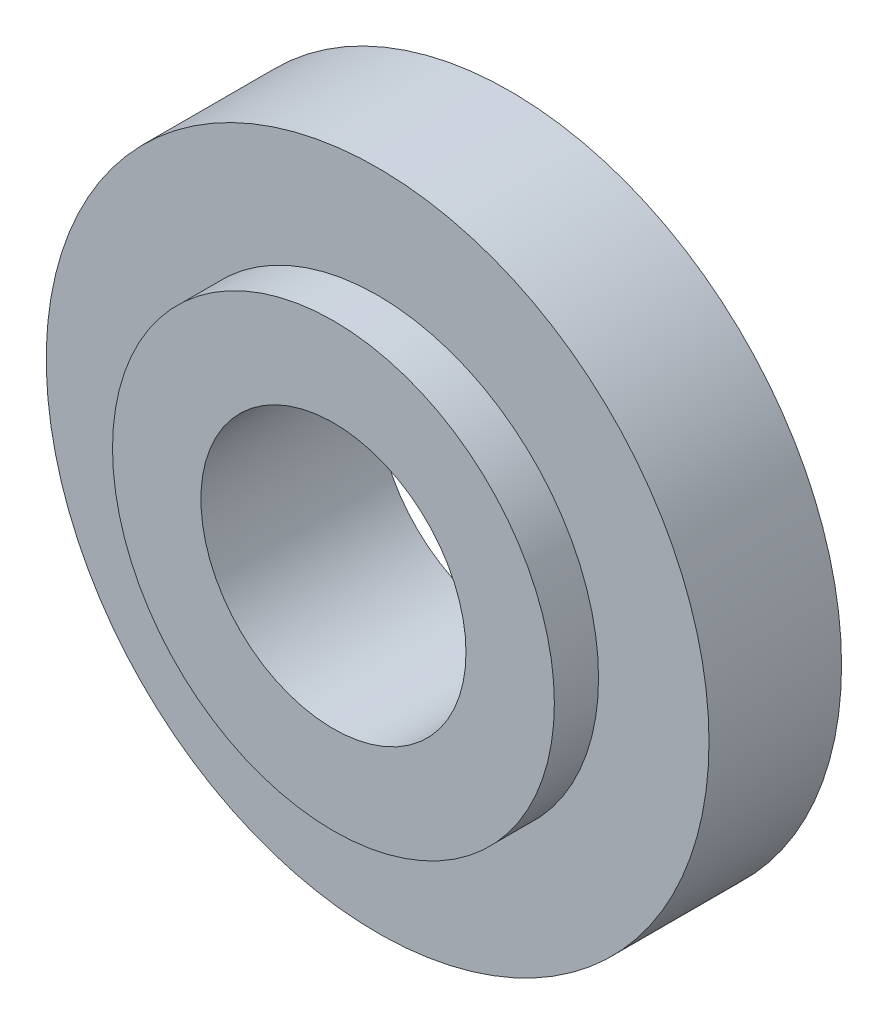
from build123d import *

# Parameters (mm, degrees)
IZIM1_R                     = 3.75
Y_KSEKLIK_EKSTR_ZYON1_DEPTH = 1.5
IZIM2_R                     = 2.5
Y_KSEKLIK_EKSTR_ZYON2_DEPTH = 0.5
IZIM3_R                     = 1.5
KES_EKSTR_ZYON1_DEPTH       = 4.5


with BuildPart() as part:
    # Çizim1 → Yükseklik-Ekstrüzyon1 (new body)
    with BuildSketch(Plane.XY):
        Circle(IZIM1_R)
    extrude(amount=Y_KSEKLIK_EKSTR_ZYON1_DEPTH)

    # Çizim2 → Yükseklik-Ekstrüzyon2 (add)
    with BuildSketch(Plane.XY.offset(1.5)):
        Circle(IZIM2_R)
    extrude(amount=Y_KSEKLIK_EKSTR_ZYON2_DEPTH)

    # Çizim3 → Kes-Ekstrüzyon1 (cut)
    with BuildSketch(Plane.XY.offset(2)):
        Circle(IZIM3_R)
    extrude(amount=-KES_EKSTR_ZYON1_DEPTH, mode=Mode.SUBTRACT)


solid = part.part
